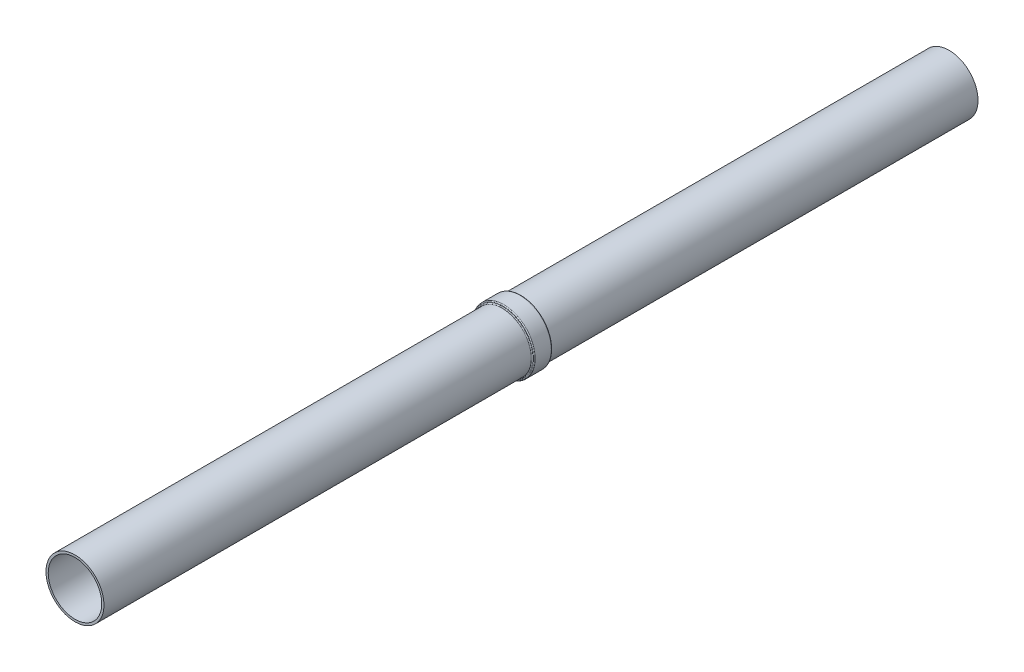
from build123d import *

# Parameters (mm, degrees)
SKETCH1_R           = 41.275
SKETCH1_R_2         = 38.1
BOSS_EXTRUDE1_DEPTH = 609.6
SKETCH3_R           = 44.45
BOSS_EXTRUDE2_DEPTH = 25.4
SKETCH5_R           = 41.275
SKETCH5_R_2         = 38.1
BOSS_EXTRUDE4_DEPTH = 609.6
FILLET1_R           = 1.27


with BuildPart() as part:
    # Sketch1 → Boss-Extrude1 (new body)
    with BuildSketch(Plane.XY):
        with Locations(Location((0, 0, 0), (0, 0, 180))):
            Circle(SKETCH1_R)
        with Locations(Location((0, 0, 0), (0, 0, 180))):
            Circle(SKETCH1_R_2, mode=Mode.SUBTRACT)
    extrude(amount=BOSS_EXTRUDE1_DEPTH)

    # Sketch3 → Boss-Extrude2 (add)
    with BuildSketch(Plane.XY.offset(609.6)):
        Circle(SKETCH3_R)
    extrude(amount=BOSS_EXTRUDE2_DEPTH)

    # Sketch5 → Boss-Extrude4 (add)
    with BuildSketch(Plane.XY.offset(635)):
        with Locations(Location((0, 0, 0), (0, 0, 180))):
            Circle(SKETCH5_R)
        with Locations(Location((0, 0, 0), (0, 0, 180))):
            Circle(SKETCH5_R_2, mode=Mode.SUBTRACT)
    extrude(amount=BOSS_EXTRUDE4_DEPTH)

    # Fillet1
    fillet1_edges = [part.edges().sort_by_distance(p)[0] for p in [
        (-44.45, 0, 609.6),
        (-44.45, 0, 635),
        (41.275, 0, 635),
        (41.275, 0, 609.6),
    ]]
    fillet(fillet1_edges, radius=FILLET1_R)


solid = part.part
